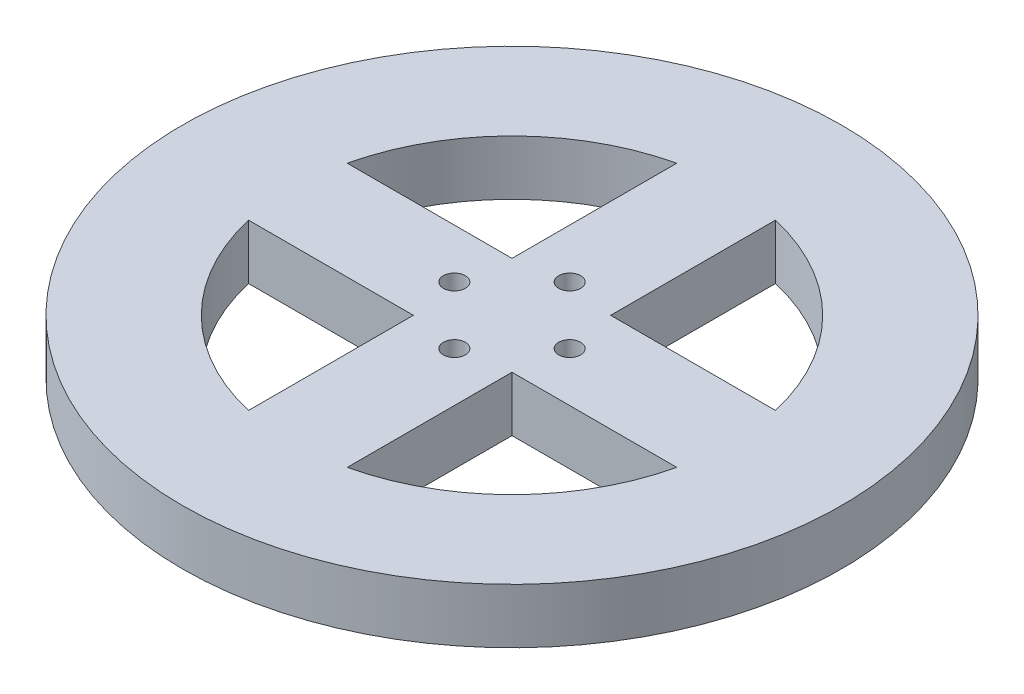
from build123d import *

# Parameters (mm, degrees)
SKETCH2_R           = 60
BOSS_EXTRUDE2_DEPTH = 10
SKETCH3_R           = 2
CUT_EXTRUDE1_DEPTH  = 86.440037453


with BuildPart() as part:
    # Sketch2 → Boss-Extrude2 (new body)
    with BuildSketch(Plane(origin=(0, 0, 0), x_dir=(1, 0, 0), z_dir=(0, 1, 0))):
        with Locations(Location((0, 0, 0), (0, 0, 270))):
            Circle(SKETCH2_R)
        with BuildLine():
            Line((-8.979157617, -38.979157617), (-8.979157617, -8.979157617))
            Line((-8.979157617, -8.979157617), (-38.979157617, -8.979157617))
            ThreePointArc((-38.979157617, -8.979157617), (-28.284271247, -28.284271247), (-8.979157617, -38.979157617))
        make_face(mode=Mode.SUBTRACT)
        with BuildLine():
            Line((-8.979157617, 8.979157617), (-8.979157617, 38.979157617))
            ThreePointArc((-8.979157617, 38.979157617), (-28.284271247, 28.284271247), (-38.979157617, 8.979157617))
            Line((-38.979157617, 8.979157617), (-8.979157617, 8.979157617))
        make_face(mode=Mode.SUBTRACT)
        with BuildLine():
            Line((8.979157617, 8.979157617), (38.979157617, 8.979157617))
            ThreePointArc((38.979157617, 8.979157617), (28.284271247, 28.284271247), (8.979157617, 38.979157617))
            Line((8.979157617, 38.979157617), (8.979157617, 8.979157617))
        make_face(mode=Mode.SUBTRACT)
        with BuildLine():
            Line((8.979157617, -8.979157617), (8.979157617, -38.979157617))
            ThreePointArc((8.979157617, -38.979157617), (28.284271247, -28.284271247), (38.979157617, -8.979157617))
            Line((38.979157617, -8.979157617), (8.979157617, -8.979157617))
        make_face(mode=Mode.SUBTRACT)
    extrude(amount=BOSS_EXTRUDE2_DEPTH)

    # Sketch3 → Cut-Extrude1 (cut, through all)
    with BuildSketch(Plane.XZ):
        with Locations(Location((-10.5, 0, 0), (0, 0, 270))):
            Circle(SKETCH3_R)
        with Locations(Location((0, 10.5, 0), (0, 0, 270))):
            Circle(SKETCH3_R)
        with Locations(Location((10.5, 0, 0), (0, 0, 270))):
            Circle(SKETCH3_R)
        with Locations(Location((0, -10.5, 0), (0, 0, 270))):
            Circle(SKETCH3_R)
    extrude(amount=-CUT_EXTRUDE1_DEPTH, mode=Mode.SUBTRACT)


solid = part.part
